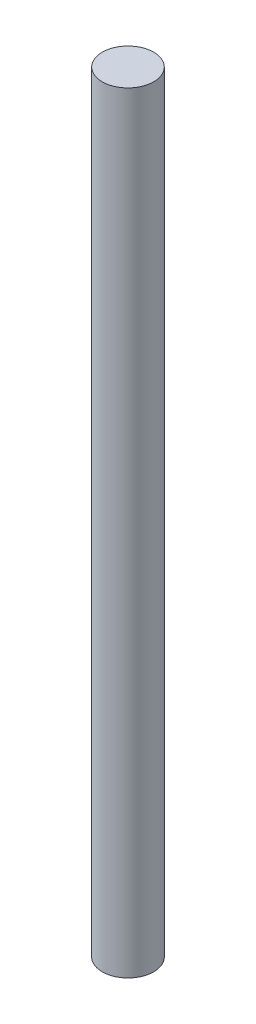
from build123d import *

# Parameters (mm, degrees)
SKETCH_1_R      = 1
EXTRUDE_1_DEPTH = 30


with BuildPart() as part:
    # 草图1 → 凸台-拉伸1 (new body)
    with BuildSketch(Plane(origin=(0, 0, 0), x_dir=(1, 0, 0), z_dir=(0, 1, 0))):
        with Locations(Location((0, 0, 0), (0, 0, 270))):
            Circle(SKETCH_1_R)
    extrude(amount=EXTRUDE_1_DEPTH)


solid = part.part
